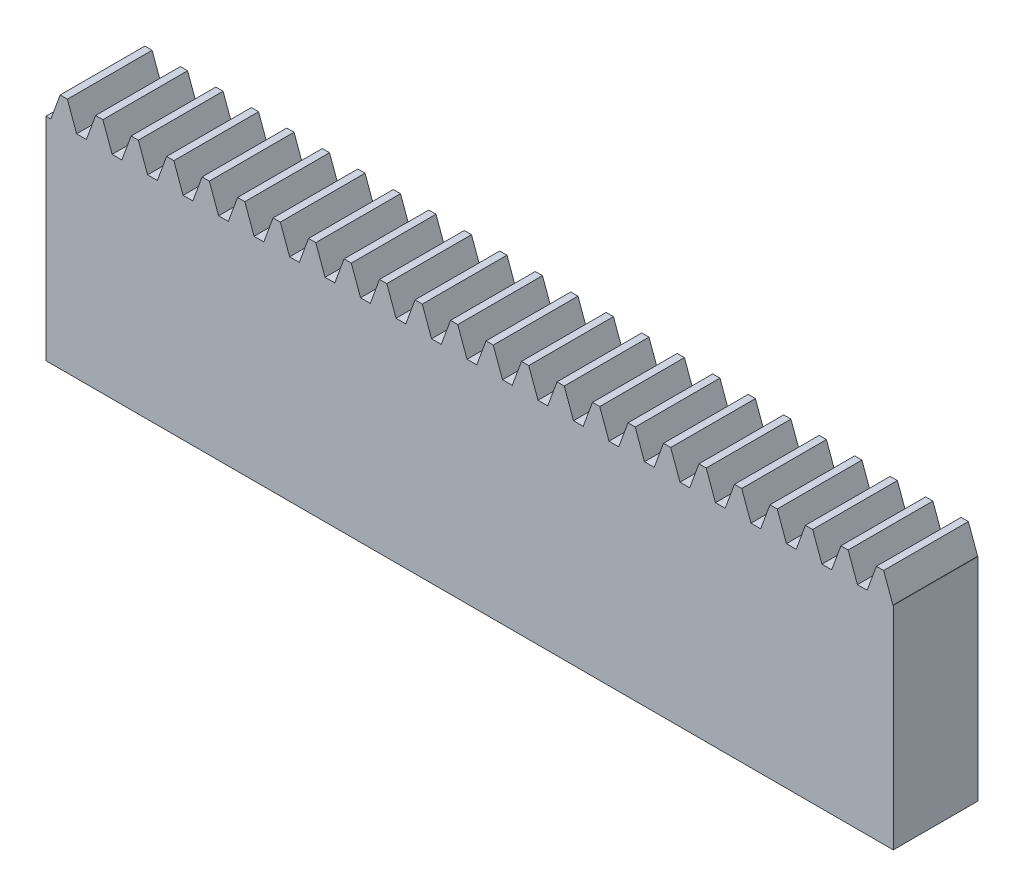
from build123d import *

# Parameters (mm, degrees)
BLANKSKE_W        = 150
BLANKSKE_H        = 42
BLANK_DEPTH       = 15
TOOTHCUTSIM_DEPTH = 157.489616269
TEETHCUTS_COUNT   = 25
TEETHCUTS_PITCH   = 6.2831853


with BuildPart() as part:
    # BlankSke → Blank (new body)
    with BuildSketch(Plane.XY):
        with Locations((75, 21)):
            Rectangle(BLANKSKE_W, BLANKSKE_H)
    extrude(amount=-BLANK_DEPTH)

    # TooCutSkeSim → ToothCutSim (cut, through all)
    with BuildSketch(Plane.XY):
        Polygon((0.861870739, 37.5), (-0.861870739, 37.5), (-2.508981637, 42.0254), (2.508981637, 42.0254), align=None)
    toothcutsim = extrude(amount=-TOOTHCUTSIM_DEPTH, mode=Mode.SUBTRACT)

    # TeethCuts: ToothCutSim ×25
    with Locations(*[(i * TEETHCUTS_PITCH, 0, 0) for i in range(1, TEETHCUTS_COUNT)]):
        add(toothcutsim, mode=Mode.SUBTRACT)


solid = part.part
